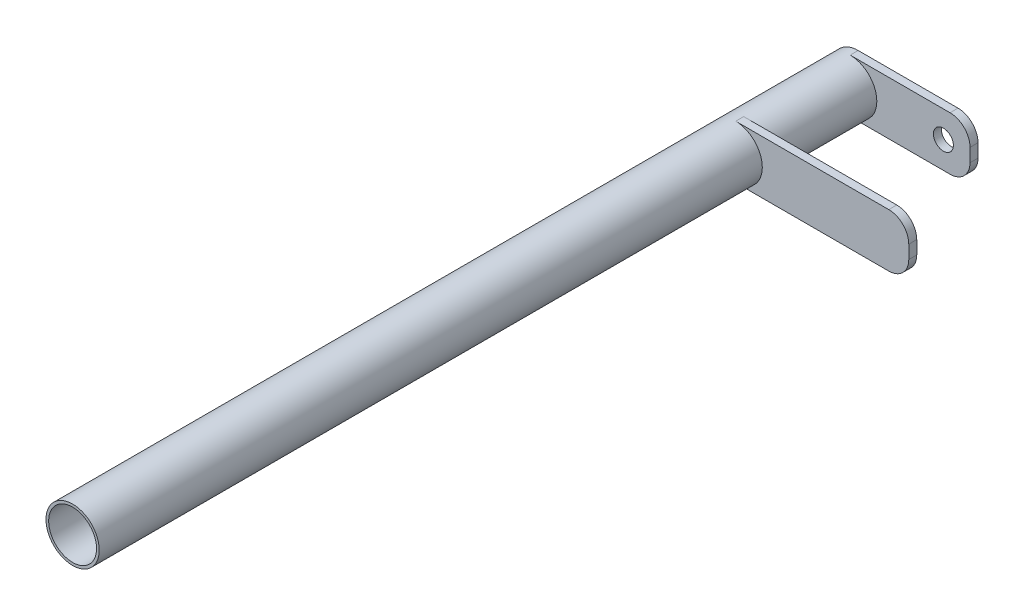
from build123d import *
from build123d.topology import SkipClean

# Parameters (mm, degrees)
ESBO_O1_R                = 20
ESBO_O1_R_2              = 18
RESSALTO_EXTRUS_O1_DEPTH = 500
RESSALTO_EXTRUS_O4_START = 90
ESBO_O2_R                = 20
ESBO_O2_R_2              = 18
RESSALTO_EXTRUS_O4_DEPTH = 90
ESBO_O4_W                = 6
ESBO_O4_H                = 40
RESSALTO_EXTRUS_O5_DEPTH = 90
ESBO_O5_R                = 18
CORTE_EXTRUS_O2_DEPTH    = 231
ESBO_O6_R                = 7.5
CORTE_EXTRUS_O3_DEPTH    = 8
ESBO_O7_W                = 6
ESBO_O7_H                = 40
RESSALTO_EXTRUS_O6_DEPTH = 40
FILETE2_R                = 15
FILETE3_R                = 15
ESBO_O8_R                = 5
CORTE_EXTRUS_O4_DEPTH    = 40


with BuildPart() as part:
    # Esboço1 → Ressalto-extrusão1 (new body)
    with BuildSketch(Plane.XY):
        Circle(ESBO_O1_R)
        Circle(ESBO_O1_R_2, mode=Mode.SUBTRACT)
    extrude(amount=RESSALTO_EXTRUS_O1_DEPTH)

    # Esboço2 → Ressalto-extrusão4 (add)
    with BuildSketch(Plane(origin=(0, 0, 0), x_dir=(-1, 0, 0), z_dir=(0, 0, -1)).offset(RESSALTO_EXTRUS_O4_START)):
        Circle(ESBO_O2_R)
        Circle(ESBO_O2_R_2, mode=Mode.SUBTRACT)
    extrude(amount=-RESSALTO_EXTRUS_O4_DEPTH)

    # Esboço4 → Ressalto-extrusão5 (add)
    with BuildSketch(Plane(origin=(0, 0, 0), x_dir=(0, 0, -1), z_dir=(1, 0, 0))):
        with Locations((87, 0)):
            Rectangle(ESBO_O4_W, ESBO_O4_H)
        with Locations((1, 0)):
            Rectangle(ESBO_O4_W, ESBO_O4_H)
    extrude(amount=RESSALTO_EXTRUS_O5_DEPTH)

    # Esboço5 → Corte-extrusão2 (cut)
    with BuildSketch(Plane(origin=(0, 0, -90), x_dir=(-1, 0, 0), z_dir=(0, 0, -1))):
        Circle(ESBO_O5_R)
    extrude(amount=-CORTE_EXTRUS_O2_DEPTH, mode=Mode.SUBTRACT)

    # Esboço6 → Corte-extrusão3 (cut)
    with BuildSketch(Plane(origin=(0, 0, -90), x_dir=(-1, 0, 0), z_dir=(0, 0, -1))):
        with Locations((-70, 0)):
            Circle(ESBO_O6_R)
    extrude(amount=-CORTE_EXTRUS_O3_DEPTH, mode=Mode.SUBTRACT)

    # Esboço7 → Ressalto-extrusão6 (add)
    with BuildSketch(Plane(origin=(90, 0, 0), x_dir=(0, 0, -1), z_dir=(1, 0, 0))):
        with Locations((1, 0)):
            Rectangle(ESBO_O7_W, ESBO_O7_H)
    extrude(amount=RESSALTO_EXTRUS_O6_DEPTH)

    # Filete2
    filete2_edges = [part.edges().sort_by_distance(p)[0] for p in [
        (90, -20, -87),
        (90, 20, -87),
    ]]
    fillet(filete2_edges, radius=FILETE2_R)

    # Filete3
    filete3_edges = [part.edges().sort_by_distance(p)[0] for p in [
        (130, -20, -1),
        (130, 20, -1),
    ]]
    fillet(filete3_edges, radius=FILETE3_R)

    # Esboço8 → Corte-extrusão4 (cut)
    with SkipClean():  # the faces are left unmerged after this step: merging them gives an invalid solid
        with BuildSketch(Plane(origin=(0, 0, 0), x_dir=(0, 0, -1), z_dir=(1, 0, 0))):
            with Locations(Location((-470, 0, 0), (0, 0, 180))):
                Circle(ESBO_O8_R)
            with Locations(Location((-430, 0, 0), (0, 0, 180))):
                Circle(ESBO_O8_R)
            with Locations(Location((-390, 0, 0), (0, 0, 180))):
                Circle(ESBO_O8_R)
            with Locations(Location((-350, 0, 0), (0, 0, 180))):
                Circle(ESBO_O8_R)
            with Locations(Location((-310, 0, 0), (0, 0, 180))):
                Circle(ESBO_O8_R)
            with Locations(Location((-270, 0, 0), (0, 0, 180))):
                Circle(ESBO_O8_R)
            with Locations(Location((-230, 0, 0), (0, 0, 180))):
                Circle(ESBO_O8_R)
            with Locations(Location((-190, 0, 0), (0, 0, 180))):
                Circle(ESBO_O8_R)
            with Locations(Location((-150, 0, 0), (0, 0, 180))):
                Circle(ESBO_O8_R)
            with Locations(Location((-110, 0, 0), (0, 0, 180))):
                Circle(ESBO_O8_R)
        extrude(amount=-CORTE_EXTRUS_O4_DEPTH, mode=Mode.SUBTRACT)


solid = part.part
